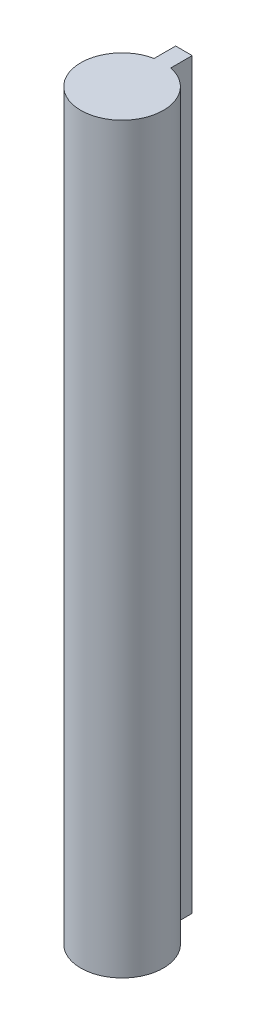
from build123d import *

# Parameters (mm, degrees)
SKETCH1_R           = 2
BOSS_EXTRUDE1_DEPTH = 45
CUT_EXTRUDE1_START  = -53
SKETCH2_R           = 4.181773236
CUT_EXTRUDE1_DEPTH  = 53
SKETCH3_R           = 2.328270144
CUT_EXTRUDE2_DEPTH  = 27


with BuildPart() as part:
    # Sketch1 → Boss-Extrude1 (new body)
    with BuildSketch(Plane(origin=(0, 0, 0), x_dir=(1, 0, 0), z_dir=(0, 1, 0))):
        Polygon((-0.5, 1.936491673), (0, 2.368245837), (0, 2.8), (-0.5, 2.8), align=None)
        Polygon((0, 2.8), (0, 2.368245837), (0.5, 2.8), align=None)
        with BuildLine():
            Line((0, 2.368245837), (0, 2))
            ThreePointArc((0, 2), (0.252008585, 1.984059393), (0.5, 1.936491673))
            Line((0.5, 1.936491673), (0.5, 2.8))
            Line((0.5, 2.8), (0, 2.368245837))
        make_face()
        with BuildLine():
            ThreePointArc((-0.5, 1.936491673), (-0.252008585, 1.984059393), (0, 2))
            Line((0, 2), (0, 2.368245837))
            Line((0, 2.368245837), (-0.5, 1.936491673))
        make_face()
        Circle(SKETCH1_R)
    extrude(amount=BOSS_EXTRUDE1_DEPTH)

    # Sketch2 → Cut-Extrude1 (cut)
    # profile 1 of 2: a face of its own
    with BuildSketch(Plane(origin=(0, 45, 0), x_dir=(1, 0, 0), z_dir=(0, 1, 0)).offset(CUT_EXTRUDE1_START)):
        Circle(SKETCH2_R)
        with BuildLine():
            Line((-0.5, 2.8), (-0.5, 1.936491673))
            ThreePointArc((-0.5, 1.936491673), (0, -2), (0.5, 1.936491673))
            Line((0.5, 1.936491673), (0.5, 2.8))
            Line((0.5, 2.8), (-0.5, 2.8))
        make_face(mode=Mode.SUBTRACT)
    # profile 2 of 2: a face of its own
    with BuildSketch(Plane(origin=(0, 45, 0), x_dir=(1, 0, 0), z_dir=(0, 1, 0)).offset(CUT_EXTRUDE1_START)):
        with BuildLine():
            Line((0.5, 2.8), (-0.5, 2.8))
            Line((-0.5, 2.8), (-0.5, 1.936491673))
            ThreePointArc((-0.5, 1.936491673), (0, -2), (0.5, 1.936491673))
            Line((0.5, 1.936491673), (0.5, 2.8))
        make_face()
        with BuildLine():
            Line((-0.20151518, 1.5), (0, 1.5))
            Line((0, 1.5), (0.2, 1.5))
            Line((0.2, 1.5), (0.2, 0.979795897))
            ThreePointArc((0.2, 0.979795897), (0.774596669, 0.632455532), (1, 0))
            ThreePointArc((1, 0), (-0.631856321, -0.775085537), (-0.20151518, 0.979485391))
            Line((-0.20151518, 0.979485391), (-0.20151518, 1.5))
        make_face(mode=Mode.SUBTRACT)
    extrude(amount=CUT_EXTRUDE1_DEPTH, mode=Mode.SUBTRACT)

    # Sketch3 → Cut-Extrude2 (cut)
    with BuildSketch(Plane(origin=(0, 45, 0), x_dir=(1, 0, 0), z_dir=(0, 1, 0))):
        Circle(SKETCH3_R)
    extrude(amount=-CUT_EXTRUDE2_DEPTH, mode=Mode.SUBTRACT)


solid = part.part
